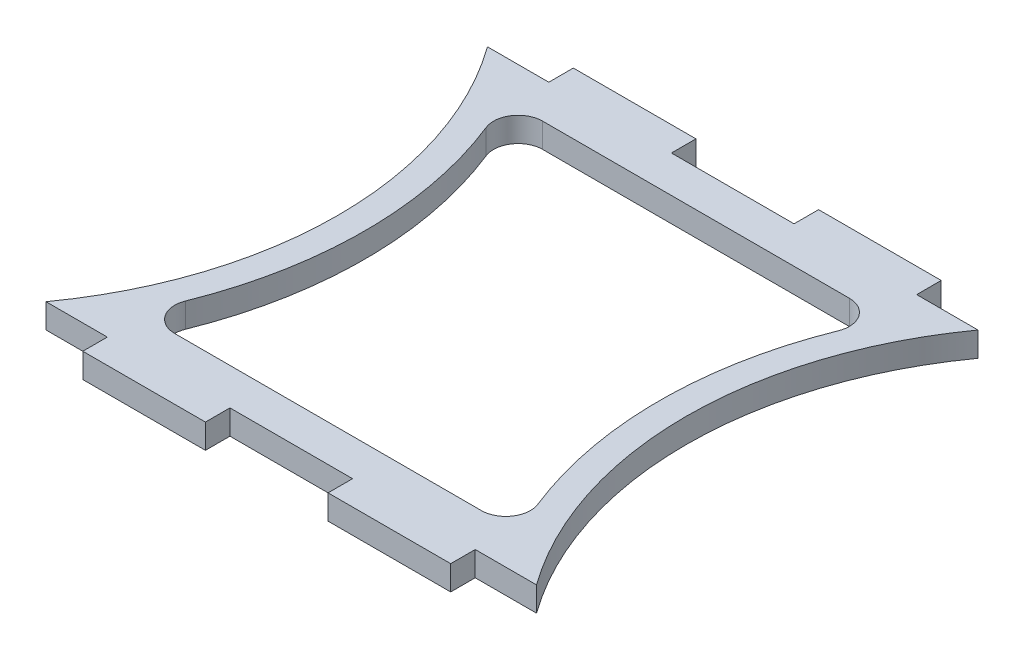
from build123d import *

# Parameters (mm, degrees)
BOSS_EXTRUDE1_DEPTH = 2


with BuildPart() as part:
    # Sketch1 → Boss-Extrude1 (new body)
    with BuildSketch(Plane(origin=(0, 0, 0), x_dir=(1, 0, 0), z_dir=(0, 1, 0))):
        with BuildLine():
            Line((-20, -18), (-15, -18))
            Line((-15, -18), (-15, -20))
            Line((-15, -20), (-5, -20))
            Line((-5, -20), (-5, -18))
            Line((-5, -18), (5, -18))
            Line((5, -18), (5, -20))
            Line((5, -20), (15, -20))
            Line((15, -20), (15, -18))
            Line((15, -18), (20, -18))
            ThreePointArc((20, -18), (14.194156399, 0), (20, 18))
            Line((20, 18), (15, 18))
            Line((15, 18), (15, 20))
            Line((15, 20), (5, 20))
            Line((5, 20), (5, 18))
            Line((5, 18), (-5, 18))
            Line((-5, 18), (-5, 20))
            Line((-5, 20), (-15, 20))
            Line((-15, 20), (-15, 18))
            Line((-15, 18), (-20, 18))
            ThreePointArc((-20, 18), (-14.194156399, 0), (-20, -18))
        make_face()
        with BuildLine():
            Line((-12.503846381, 15), (12.503846381, 15))
            ThreePointArc((12.503846381, 15), (14.160003724, 14.121223821), (14.360769445, 12.257142857))
            ThreePointArc((14.360769445, 12.257142857), (12, 0), (14.360769445, -12.257142857))
            ThreePointArc((14.360769445, -12.257142857), (14.160003724, -14.121223821), (12.503846381, -15))
            Line((12.503846381, -15), (-12.503846381, -15))
            ThreePointArc((-12.503846381, -15), (-14.160003724, -14.121223821), (-14.360769445, -12.257142857))
            ThreePointArc((-14.360769445, -12.257142857), (-12, 0), (-14.360769445, 12.257142857))
            ThreePointArc((-14.360769445, 12.257142857), (-14.160003724, 14.121223821), (-12.503846381, 15))
        make_face(mode=Mode.SUBTRACT)
    extrude(amount=BOSS_EXTRUDE1_DEPTH)


solid = part.part
